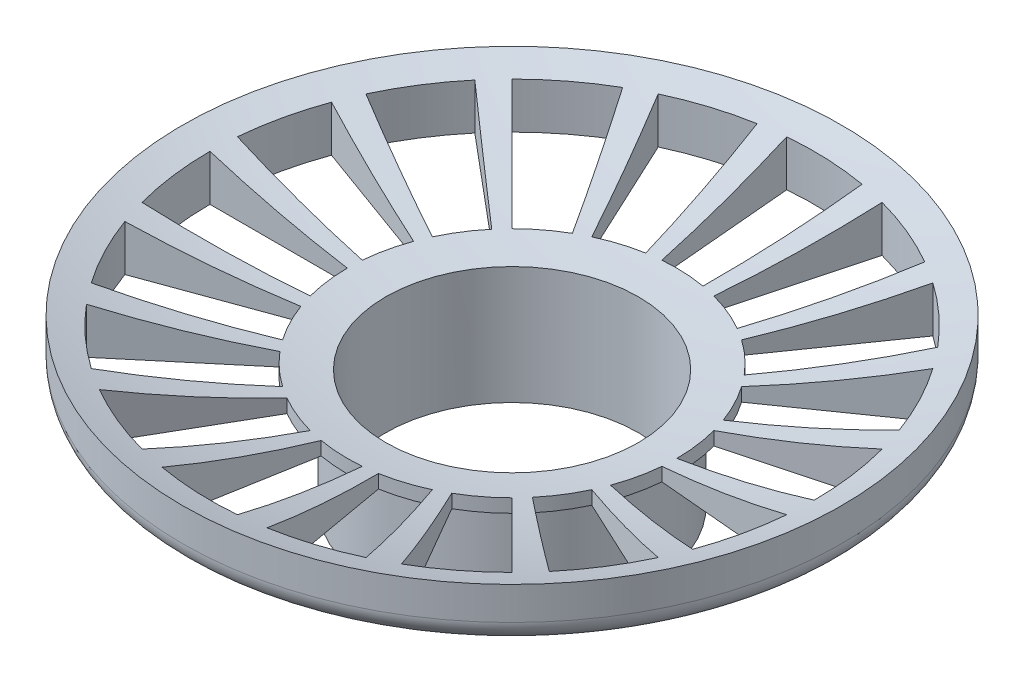
from build123d import *

# Parameters (mm, degrees)
SKETCH1_R           = 12.5
BOSS_EXTRUDE1_DEPTH = 10
SKETCH3_R           = 30
BOSS_EXTRUDE2_DEPTH = 5
DOME1_FACE_RADIUS   = 30
DOME1_HEIGHT        = 5
SKETCH8_R           = 11.5
CUT_EXTRUDE3_DEPTH  = 46
CUT_EXTRUDE4_DEPTH  = 44.588989435
FILLET2_R           = 2


with BuildPart() as part:
    # Sketch1 → Boss-Extrude1 (new body)
    with BuildSketch(Plane(origin=(0, 0, 0), x_dir=(1, 0, 0), z_dir=(0, 1, 0))):
        with Locations(Location((0, 0, 0), (0, 0, 270))):
            Circle(SKETCH1_R)
    extrude(amount=BOSS_EXTRUDE1_DEPTH)

    # Sketch3 → Boss-Extrude2 (add)
    with BuildSketch(Plane(origin=(0, 10, 0), x_dir=(1, 0, 0), z_dir=(0, 1, 0))):
        with Locations(Location((0, 0, 0), (0, 0, 270))):
            Circle(SKETCH3_R)
    extrude(amount=BOSS_EXTRUDE2_DEPTH)

    # Dome1: a dome of height H over a round flat face of radius A is a cap of a sphere of radius (A * A + H * H) / (2 * H)
    dome1_r = (DOME1_FACE_RADIUS * DOME1_FACE_RADIUS + DOME1_HEIGHT * DOME1_HEIGHT) / (2 * DOME1_HEIGHT)
    dome1_base = Plane((0, 15, 0), z_dir=(0, -1, 0))
    with Locations(dome1_base.offset(DOME1_HEIGHT - dome1_r)):
        dome1_ball = Sphere(dome1_r, mode=Mode.PRIVATE)
    add(split(dome1_ball, bisect_by=dome1_base, keep=Keep.TOP, mode=Mode.PRIVATE), mode=Mode.SUBTRACT)

    # Sketch8 → Cut-Extrude3 (cut, through all)
    with BuildSketch(Plane.XZ):
        with Locations(Location((0, 0, 0), (0, 0, 270))):
            Circle(SKETCH8_R)
    extrude(amount=-CUT_EXTRUDE3_DEPTH, mode=Mode.SUBTRACT)

    # Sketch9 → Cut-Extrude4 (cut, through all)
    with BuildSketch(Plane.XZ.offset(-10)):
        with BuildLine():
            Line((-15, 0), (-27.5, 0))
            ThreePointArc((-27.5, 0), (-27.264733688, 3.589470286), (-26.562960223, 7.11752374))
            Line((-26.562960223, 7.11752374), (-14.488887394, 3.882285677))
            ThreePointArc((-14.488887394, 3.882285677), (-14.871672921, 1.957892883), (-15, 0))
        make_face()
        with BuildLine():
            Line((-12.287280664, 8.603646545), (-22.526681218, 15.773352))
            ThreePointArc((-22.526681218, 15.773352), (-24.392797912, 12.698086864), (-25.841547072, 9.405553941))
            Line((-25.841547072, 9.405553941), (-14.095389312, 5.13030215))
            ThreePointArc((-14.095389312, 5.13030215), (-13.305162498, 6.926229199), (-12.287280664, 8.603646545))
        make_face()
        with BuildLine():
            Line((-8.603646545, 12.287280664), (-15.773352, 22.526681218))
            ThreePointArc((-15.773352, 22.526681218), (-18.578730709, 20.275126762), (-21.066222186, 17.676659266))
            Line((-21.066222186, 17.676659266), (-11.490666647, 9.641814145))
            ThreePointArc((-11.490666647, 9.641814145), (-10.133853114, 11.059160052), (-8.603646545, 12.287280664))
        make_face()
        with BuildLine():
            Line((-3.882285677, 14.488887394), (-7.11752374, 26.562960223))
            ThreePointArc((-7.11752374, 26.562960223), (-10.52379439, 25.406687144), (-13.75, 23.815698604))
            Line((-13.75, 23.815698604), (-7.5, 12.990381057))
            ThreePointArc((-7.5, 12.990381057), (-5.740251485, 13.858192988), (-3.882285677, 14.488887394))
        make_face()
        with BuildLine():
            Line((1.307336141, 14.942920471), (2.396782926, 27.395354198))
            ThreePointArc((2.396782926, 27.395354198), (-1.199533153, 27.473826094), (-4.775324886, 27.082213208))
            Line((-4.775324886, 27.082213208), (-2.604722665, 14.772116295))
            ThreePointArc((-2.604722665, 14.772116295), (-0.65429081, 14.985723324), (1.307336141, 14.942920471))
        make_face()
        with BuildLine():
            Line((6.339273926, 13.594616806), (11.622002198, 24.923464144))
            ThreePointArc((11.622002198, 24.923464144), (8.269409486, 26.227216146), (4.775324886, 27.082213208))
            Line((4.775324886, 27.082213208), (2.604722665, 14.772116295))
            ThreePointArc((2.604722665, 14.772116295), (4.510586993, 14.305754261), (6.339273926, 13.594616806))
        make_face()
        with BuildLine():
            Line((10.606601718, 10.606601718), (19.445436483, 19.445436483))
            ThreePointArc((19.445436483, 19.445436483), (16.740939298, 21.817216858), (13.75, 23.815698604))
            Line((13.75, 23.815698604), (7.5, 12.990381057))
            ThreePointArc((7.5, 12.990381057), (9.131421435, 11.900300104), (10.606601718, 10.606601718))
        make_face()
        with BuildLine():
            Line((13.594616806, 6.339273926), (24.923464144, 11.622002198))
            ThreePointArc((24.923464144, 11.622002198), (23.19326476, 14.77573923), (21.066222186, 17.676659266))
            Line((21.066222186, 17.676659266), (11.490666647, 9.641814145))
            ThreePointArc((11.490666647, 9.641814145), (12.650871687, 8.059494125), (13.594616806, 6.339273926))
        make_face()
        with BuildLine():
            Line((14.942920471, 1.307336141), (27.395354198, 2.396782926))
            ThreePointArc((27.395354198, 2.396782926), (26.848140196, 5.952089383), (25.841547072, 9.405553941))
            Line((25.841547072, 9.405553941), (14.095389312, 5.13030215))
            ThreePointArc((14.095389312, 5.13030215), (14.644440107, 3.246594209), (14.942920471, 1.307336141))
        make_face()
        with BuildLine():
            Line((14.488887394, -3.882285677), (26.562960223, -7.11752374))
            ThreePointArc((26.562960223, -7.11752374), (27.264733688, -3.589470286), (27.5, 0))
            Line((27.5, 0), (15, 0))
            ThreePointArc((15, 0), (14.871672921, -1.957892883), (14.488887394, -3.882285677))
        make_face()
        with BuildLine():
            Line((12.287280664, -8.603646545), (22.526681218, -15.773352))
            ThreePointArc((22.526681218, -15.773352), (24.392797912, -12.698086864), (25.841547072, -9.405553941))
            Line((25.841547072, -9.405553941), (14.095389312, -5.13030215))
            ThreePointArc((14.095389312, -5.13030215), (13.305162498, -6.926229199), (12.287280664, -8.603646545))
        make_face()
        with BuildLine():
            Line((8.603646545, -12.287280664), (15.773352, -22.526681218))
            ThreePointArc((15.773352, -22.526681218), (18.578730709, -20.275126762), (21.066222186, -17.676659266))
            Line((21.066222186, -17.676659266), (11.490666647, -9.641814145))
            ThreePointArc((11.490666647, -9.641814145), (10.133853114, -11.059160052), (8.603646545, -12.287280664))
        make_face()
        with BuildLine():
            Line((3.882285677, -14.488887394), (7.11752374, -26.562960223))
            ThreePointArc((7.11752374, -26.562960223), (10.52379439, -25.406687144), (13.75, -23.815698604))
            Line((13.75, -23.815698604), (7.5, -12.990381057))
            ThreePointArc((7.5, -12.990381057), (5.740251485, -13.858192988), (3.882285677, -14.488887394))
        make_face()
        with BuildLine():
            Line((-1.307336141, -14.942920471), (-2.396782926, -27.395354198))
            ThreePointArc((-2.396782926, -27.395354198), (1.199533153, -27.473826094), (4.775324886, -27.082213208))
            Line((4.775324886, -27.082213208), (2.604722665, -14.772116295))
            ThreePointArc((2.604722665, -14.772116295), (0.65429081, -14.985723324), (-1.307336141, -14.942920471))
        make_face()
        with BuildLine():
            Line((-6.339273926, -13.594616806), (-11.622002198, -24.923464144))
            ThreePointArc((-11.622002198, -24.923464144), (-8.269409486, -26.227216146), (-4.775324886, -27.082213208))
            Line((-4.775324886, -27.082213208), (-2.604722665, -14.772116295))
            ThreePointArc((-2.604722665, -14.772116295), (-4.510586993, -14.305754261), (-6.339273926, -13.594616806))
        make_face()
        with BuildLine():
            Line((-10.606601718, -10.606601718), (-19.445436483, -19.445436483))
            ThreePointArc((-19.445436483, -19.445436483), (-16.740939298, -21.817216858), (-13.75, -23.815698604))
            Line((-13.75, -23.815698604), (-7.5, -12.990381057))
            ThreePointArc((-7.5, -12.990381057), (-9.131421435, -11.900300104), (-10.606601718, -10.606601718))
        make_face()
        with BuildLine():
            Line((-13.594616806, -6.339273926), (-24.923464144, -11.622002198))
            ThreePointArc((-24.923464144, -11.622002198), (-23.19326476, -14.77573923), (-21.066222186, -17.676659266))
            Line((-21.066222186, -17.676659266), (-11.490666647, -9.641814145))
            ThreePointArc((-11.490666647, -9.641814145), (-12.650871687, -8.059494125), (-13.594616806, -6.339273926))
        make_face()
        with BuildLine():
            Line((-14.942920471, -1.307336141), (-27.395354198, -2.396782926))
            ThreePointArc((-27.395354198, -2.396782926), (-26.848140196, -5.952089383), (-25.841547072, -9.405553941))
            Line((-25.841547072, -9.405553941), (-14.095389312, -5.13030215))
            ThreePointArc((-14.095389312, -5.13030215), (-14.644440107, -3.246594209), (-14.942920471, -1.307336141))
        make_face()
    extrude(amount=-CUT_EXTRUDE4_DEPTH, mode=Mode.SUBTRACT)

    # Fillet2
    fillet2_edges = [part.edges().sort_by_distance(p)[0] for p in [
        (0, 10, -30),
    ]]
    fillet(fillet2_edges, radius=FILLET2_R)


solid = part.part
